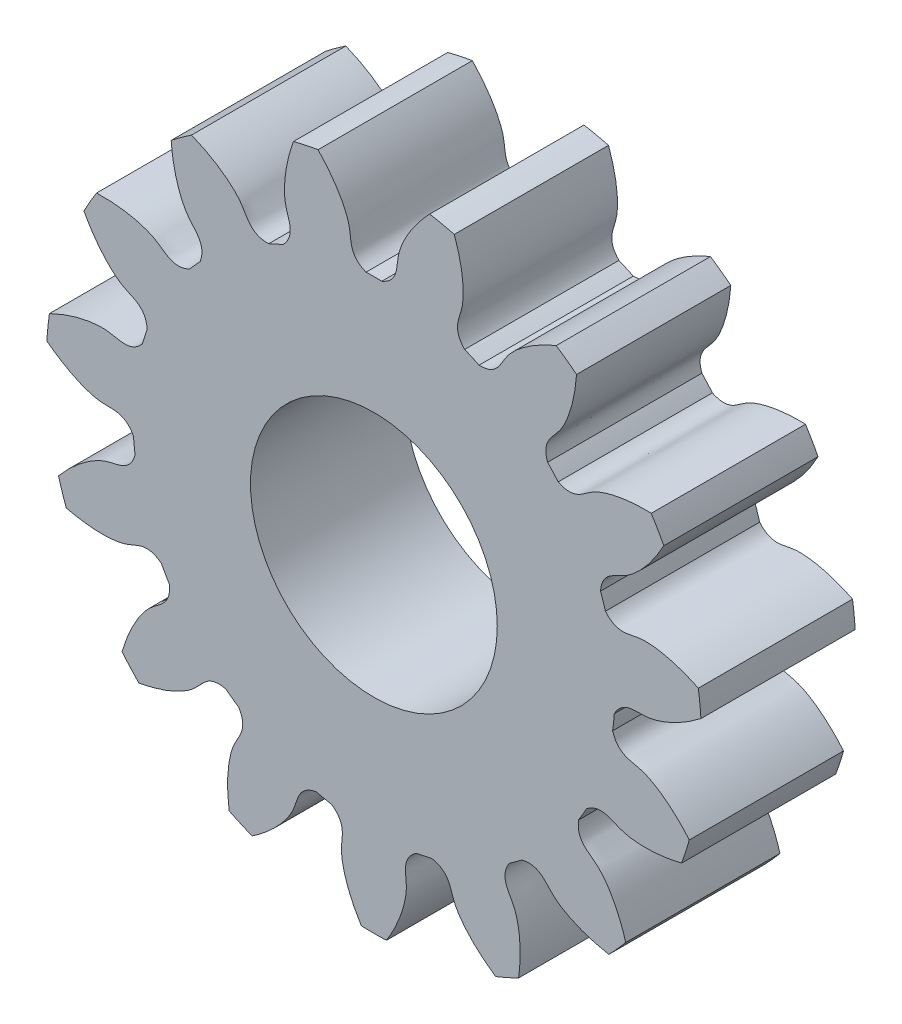
from build123d import *

# Parameters (mm, degrees)
SKETCH_1_R               = 4.25
EXTRUDE_1_DEPTH          = 2
CUT_EXTRUDE_1_DEPTH      = 7.33442973
PATTERN_CIRCULAR_1_COUNT = 15
CUT_EXTRUDE_2_REACH      = 8.328
SKETCH_4_R               = 1.6


with BuildPart() as part:
    # 草图1 → 凸台-拉伸1 (new body)
    with BuildSketch(Plane.XY):
        Circle(SKETCH_1_R)
    extrude(amount=EXTRUDE_1_DEPTH)

    # 草图2 → 切除-拉伸1 (cut, through all)
    with BuildSketch(Plane.XY):
        with BuildLine():
            ThreePointArc((0.102142521, 3.123330259), (0, 3.125), (-0.102142521, 3.123330259))
            add(Edge.make_bspline(
                [(-0.102142521, 3.123330259), (-0.328606529, 3.217205114), (-0.286056567, 3.393164711), (-0.325630243, 3.554251883), (-0.328716589, 3.565829148), (-0.332424424, 3.578696912), (-0.336805119, 3.592834652), (-0.341911201, 3.608219988), (-0.347794015, 3.624829049), (-0.354504401, 3.642636383), (-0.362092429, 3.661615009), (-0.370607425, 3.68173642), (-0.380097912, 3.702970613), (-0.390611575, 3.725286105), (-0.402195217, 3.748649954), (-0.414894726, 3.773027785), (-0.42875503, 3.798383812), (-0.443820065, 3.824680861), (-0.460132732, 3.851880399), (-0.477734865, 3.87994256), (-0.496667191, 3.908826169), (-0.516969298, 3.938488777), (-0.538679598, 3.968886682), (-0.561835294, 3.999974966), (-0.586472345, 4.031707525), (-0.612625439, 4.064037097), (-0.640327952, 4.096915299), (-0.669611928, 4.130292659), (-0.70050804, 4.164118648), (-0.733045564, 4.198341721), (-0.767252353, 4.232909346), (-0.803154806, 4.267768045), (-0.840777842, 4.30286343), (-0.880144878, 4.33814024), (-0.921277797, 4.373542382), (-0.964196933, 4.409012967), (-1.008921041, 4.444494353), (-1.055467278, 4.479928182), (-1.103851182, 4.515255425), (-1.154086653, 4.550416421), (-1.206185932, 4.585350919), (-1.260159587, 4.619998121), (-1.316016488, 4.654296726), (-1.373763805, 4.688184973), (-1.433406971, 4.721600685), (-1.516292831, 4.765884352), (-1.580075957, 4.797516983), (-1.623419194, 4.817964103)],
                knots=[0, 0, 0, 0, 0.202473101, 0.206978902, 0.212085478, 0.217792827, 0.224100949, 0.231009845, 0.238519514, 0.246629958, 0.255341174, 0.264653164, 0.274565928, 0.285079465, 0.296193776, 0.307908861, 0.320224719, 0.33314135, 0.346658755, 0.360776934, 0.375495886, 0.390815612, 0.406736111, 0.423257384, 0.440379431, 0.458102251, 0.476425844, 0.495350211, 0.514875352, 0.535001266, 0.555727954, 0.577055415, 0.59898365, 0.621512658, 0.64464244, 0.668372996, 0.692704325, 0.717636428, 0.743169304, 0.769302954, 0.796037377, 0.823372574, 0.851308544, 0.879845288, 0.908982806, 0.938721097, 1, 1, 1, 1], degree=3))
            ThreePointArc((-1.623419194, 4.817964103), (0, 5.084119194), (1.623419194, 4.817964103))
            add(Edge.make_bspline(
                [(0.102142521, 3.123330259), (0.328606529, 3.217205114), (0.286056567, 3.393164711), (0.325630243, 3.554251883), (0.328716589, 3.565829148), (0.332424424, 3.578696912), (0.336805119, 3.592834652), (0.341911201, 3.608219988), (0.347794015, 3.624829049), (0.354504401, 3.642636383), (0.362092429, 3.661615009), (0.370607425, 3.68173642), (0.380097912, 3.702970613), (0.390611575, 3.725286105), (0.402195217, 3.748649954), (0.414894726, 3.773027785), (0.42875503, 3.798383812), (0.443820065, 3.824680861), (0.460132732, 3.851880399), (0.477734865, 3.87994256), (0.496667191, 3.908826169), (0.516969298, 3.938488777), (0.538679598, 3.968886682), (0.561835294, 3.999974966), (0.586472345, 4.031707525), (0.612625439, 4.064037097), (0.640327952, 4.096915299), (0.669611928, 4.130292659), (0.70050804, 4.164118648), (0.733045564, 4.198341721), (0.767252353, 4.232909346), (0.803154806, 4.267768045), (0.840777842, 4.30286343), (0.880144878, 4.33814024), (0.921277797, 4.373542382), (0.964196933, 4.409012967), (1.008921041, 4.444494353), (1.055467278, 4.479928182), (1.103851182, 4.515255425), (1.154086653, 4.550416421), (1.206185932, 4.585350919), (1.260159587, 4.619998121), (1.316016488, 4.654296726), (1.373763805, 4.688184973), (1.433406971, 4.721600685), (1.516292831, 4.765884352), (1.580075957, 4.797516983), (1.623419194, 4.817964103)],
                knots=[0, 0, 0, 0, 0.202473101, 0.206978902, 0.212085478, 0.217792827, 0.224100949, 0.231009845, 0.238519514, 0.246629958, 0.255341174, 0.264653164, 0.274565928, 0.285079465, 0.296193776, 0.307908861, 0.320224719, 0.33314135, 0.346658755, 0.360776934, 0.375495886, 0.390815612, 0.406736111, 0.423257384, 0.440379431, 0.458102251, 0.476425844, 0.495350211, 0.514875352, 0.535001266, 0.555727954, 0.577055415, 0.59898365, 0.621512658, 0.64464244, 0.668372996, 0.692704325, 0.717636428, 0.743169304, 0.769302954, 0.796037377, 0.823372574, 0.851308544, 0.879845288, 0.908982806, 0.938721097, 1, 1, 1, 1], degree=3))
        make_face()
    cut_extrude_1 = extrude(amount=CUT_EXTRUDE_1_DEPTH, mode=Mode.SUBTRACT)

    # 阵列(圆周)1: 切除-拉伸1 ×15 about axis
    pattern_circular_1_axis = Axis((0, 0, 2), (0, 0, -1))
    for i in range(1, PATTERN_CIRCULAR_1_COUNT):
        add(cut_extrude_1.rotate(pattern_circular_1_axis, i * 360 / PATTERN_CIRCULAR_1_COUNT), mode=Mode.SUBTRACT)

    # 草图4 → 切除-拉伸2 (cut, up to next)
    with BuildSketch(Plane.XY.offset(2), mode=Mode.PRIVATE) as cut_extrude_2_sk1:
        Circle(SKETCH_4_R)
    cut_extrude_2_tool1 = extrude(cut_extrude_2_sk1.sketch, amount=-CUT_EXTRUDE_2_REACH, mode=Mode.PRIVATE) & part.part
    add(cut_extrude_2_tool1.solids().sort_by_distance((0, 0, 2))[0], mode=Mode.SUBTRACT)


solid = part.part
